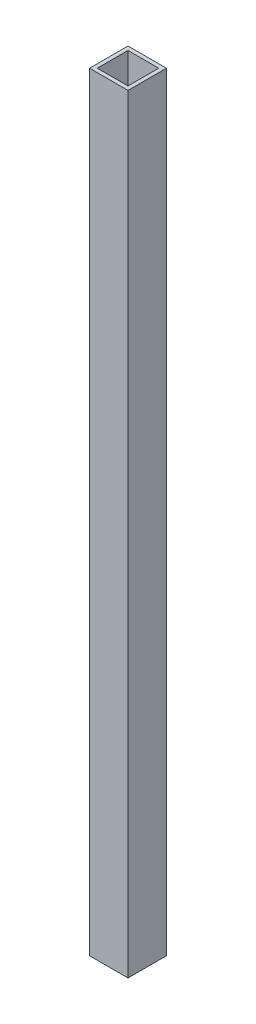
from build123d import *

# Parameters (mm, degrees)
SKETCH1_W           = 20
SKETCH1_H           = 20
SKETCH1_W_2         = 16
SKETCH1_H_2         = 16
BOSS_EXTRUDE1_DEPTH = 400


with BuildPart() as part:
    # Sketch1 → Boss-Extrude1 (new body)
    with BuildSketch(Plane(origin=(0, 0, 0), x_dir=(1, 0, 0), z_dir=(0, 1, 0))):
        Rectangle(SKETCH1_W, SKETCH1_H)
        Rectangle(SKETCH1_W_2, SKETCH1_H_2, mode=Mode.SUBTRACT)
    extrude(amount=BOSS_EXTRUDE1_DEPTH)


solid = part.part
